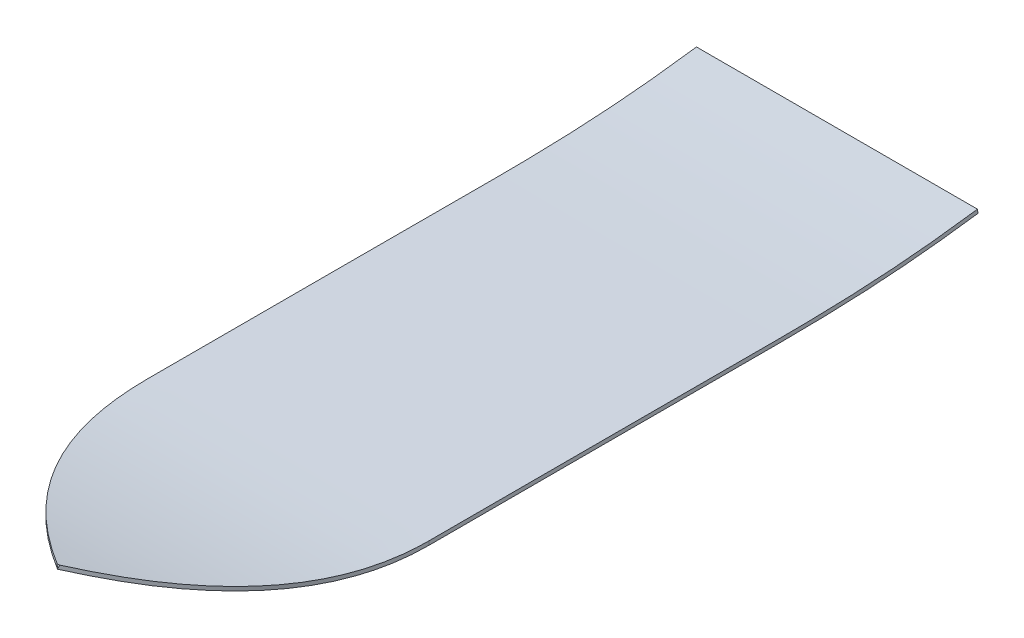
from build123d import *

# Parameters (mm, degrees)
BOSS_EXTRUDE1_DEPTH      = 1524
BOSS_EXTRUDE1_DEPTH_BACK = 1524
CUT_EXTRUDE1_DEPTH       = 3098.447821487
CUT_EXTRUDE1_DEPTH_BACK  = 3098.447821487
SKETCH3_W                = 5731.45735109
SKETCH3_H                = 8003.30588206


with BuildPart() as part:
    # Sketch1 → Boss-Extrude1 (new, two sides: drawn at the far end of the back side and taken through both)
    with BuildSketch(Plane(origin=(0, 0, 0), x_dir=(0, 0, -1), z_dir=(1, 0, 0)).offset(-BOSS_EXTRUDE1_DEPTH_BACK)):
        with BuildLine():
            Line((-2353.490963465, -376.584606087), (-2348.039723593, -352.186163845))
            add(Edge.make_bspline(
                [(-2348.039723593, -352.186163845), (-2281.6738737, -367.014002585), (-2145.036602461, -397.354481422), (-1955.256616807, -429.884051114), (-1782.28988813, -454.42437367), (-1631.35939755, -471.996800914), (-1477.832014657, -486.206040379), (-1315.18129302, -497.476466704), (-1143.018170233, -505.304212274), (-1011.507391034, -508.081800201), (-929.720530859, -508.681005908), (-905.793973442, -508.762455141), (-888.668966845, -508.775812404), (-868.10178753, -508.769602755), (-768.707408439, -508.757272838), (-590.482173842, -508.734088186), (-316.288189813, -508.696715915), (-14.674899897, -508.655726234), (314.357795542, -508.610990104), (677.664730089, -508.561593962), (951.858615248, -508.522926374), (1124.943610655, -508.503796038), (1155.78937311, -508.512090205), (1167.787147852, -508.486000899), (1176.347816812, -508.587253885), (1197.689978263, -508.761102451), (1294.258027958, -509.449807286), (1408.722423658, -509.443255017), (1531.687347091, -508.118726482), (1606.796786484, -506.846040881), (1681.020023121, -505.093260979), (1754.520691799, -502.832440084), (1827.461095667, -500.036457542), (1924.190978685, -495.55466042), (2044.492665021, -488.492256563), (2213.50789637, -475.490937752), (2408.667866621, -456.44949581), (2562.784610399, -436.038918355), (2639.842982287, -425.833629628)],
                knots=[0.002527185, 0.002527185, 0.002527185, 0.002527185, 0.046875, 0.09375, 0.125, 0.15625, 0.1875, 0.21875, 0.25390625, 0.2890625, 0.294921875, 0.30078125, 0.302734375, 0.3046875, 0.3125, 0.359375, 0.40625, 0.46875, 0.53125, 0.59375, 0.67578125, 0.6875, 0.692382812, 0.693359375, 0.694335938, 0.697265625, 0.705566406, 0.75, 0.765625, 0.78125, 0.796875, 0.8125, 0.828125, 0.84375, 0.875, 0.90625, 0.953125, 1, 1, 1, 1], degree=3))
            Line((2639.842982287, -425.833629628), (2643.125218945, -450.617231515))
            add(Edge.make_bspline(
                [(-2353.490963465, -376.584606087), (-2341.81715528, -379.192835252), (-2318.483163292, -384.400676726), (-2271.676988037, -394.754475772), (-2212.90304103, -407.455435482), (-2141.599907413, -421.947184483), (-2069.463250553, -435.350726797), (-1996.644398819, -447.790733752), (-1898.742240086, -463.225422643), (-1774.853328452, -480.583246216), (-1623.513682306, -497.941169046), (-1469.625311519, -511.942724458), (-1313.140636083, -522.554949189), (-1180.58779835, -528.583557355), (-1073.252288744, -531.716582956), (-1005.631489175, -532.971211102), (-951.207524783, -533.552085557), (-917.067998419, -533.740725986), (-889.647943185, -533.780490952), (-862.287186659, -533.765712964), (-828.107299818, -533.7657076), (-787.080038096, -533.759175111), (-732.380917206, -533.752630625), (-636.655460733, -533.739919525), (-499.905395342, -533.721788597), (-335.804664178, -533.699372735), (-171.704110201, -533.677070131), (-7.60352333, -533.654761868), (156.497058307, -533.632453691), (320.597642313, -533.610142066), (484.698231036, -533.587829734), (648.798882925, -533.56532168), (785.549328587, -533.546290869), (894.949580645, -533.531600009), (963.324680061, -533.522824353), (1018.02479195, -533.516037432), (1059.049720286, -533.51133736), (1093.237616721, -533.506910258), (1117.165344366, -533.506162519), (1130.838374939, -533.506963832), (1141.090310784, -533.508828963), (1149.648034144, -533.509381469), (1156.503452511, -533.50504743), (1160.790900683, -533.500162564), (1164.225316727, -533.493292797), (1166.696889658, -533.491829219), (1169.074115262, -533.504941801), (1171.573238532, -533.531729037), (1174.165233642, -533.560286074), (1177.598314417, -533.594374084), (1183.596284408, -533.647890401), (1192.102050573, -533.71404517), (1205.680140041, -533.817160188), (1229.349222691, -533.981509955), (1262.907726008, -534.165058875), (1316.067262702, -534.339023224), (1381.573298455, -534.325988137), (1458.830900277, -533.913280533), (1534.901440856, -533.076258507), (1634.96164713, -531.357095022), (1757.876509137, -528.009155765), (1903.211676777, -521.844090886), (2047.653049228, -513.333940218), (2168.434252599, -504.024862577), (2265.66369639, -495.324461833), (2339.250884359, -488.037032468), (2413.836412297, -479.855137369), (2489.664662871, -470.659158673), (2566.226101757, -460.801462085), (2617.514861733, -454.008960193), (2643.125218945, -450.617231515)],
                knots=[0.002527185, 0.002527185, 0.002527185, 0.002527185, 0.010319941, 0.018112698, 0.03369821, 0.049283723, 0.064869236, 0.080454749, 0.096040261, 0.127211287, 0.158382312, 0.189553338, 0.220724363, 0.251895389, 0.267480901, 0.283066414, 0.290859171, 0.298651927, 0.302548305, 0.306444683, 0.31423744, 0.322030196, 0.329822952, 0.345408465, 0.376579491, 0.407750516, 0.438921542, 0.470092567, 0.501263592, 0.532434618, 0.563605643, 0.594776669, 0.625947694, 0.641533207, 0.65711872, 0.664911476, 0.672704233, 0.680496989, 0.684393367, 0.686341556, 0.688289745, 0.690237934, 0.691212029, 0.692186123, 0.692673171, 0.693160218, 0.693647265, 0.694134313, 0.69462136, 0.695108407, 0.696082502, 0.698030691, 0.69997888, 0.703875258, 0.711668014, 0.719460771, 0.735046283, 0.750631796, 0.766217309, 0.781802822, 0.812973847, 0.844144873, 0.875315898, 0.906486924, 0.922072436, 0.937657949, 0.953243462, 0.968828975, 0.984414487, 1, 1, 1, 1], degree=3))
        make_face()
    extrude(amount=BOSS_EXTRUDE1_DEPTH + BOSS_EXTRUDE1_DEPTH_BACK)

    # Sketch3 → Cut-Extrude1 (cut, two sides: drawn at the far end of the back side and taken through both)
    with BuildSketch(Plane(origin=(0, 0, 0), x_dir=(1, 0, 0), z_dir=(0, 1, 0)).offset(-CUT_EXTRUDE1_DEPTH_BACK)):
        with Locations((-68.47307406, 83.588987295)):
            Rectangle(SKETCH3_W, SKETCH3_H)
        with BuildLine():
            Line((-900, 2643.745048715), (900, 2643.745048715))
            Line((900, 2643.745048715), (900, -873.788601837))
            add(Edge.make_bspline(
                [(900, -873.788601837), (900, -1748.42720702), (0, -2353.490963465)],
                knots=[0, 0, 0, 1, 1, 1], degree=2))
            add(Edge.make_bspline(
                [(-900, -873.788601837), (-900, -1748.42720702), (0, -2353.490963465)],
                knots=[0, 0, 0, 1, 1, 1], degree=2))
            Line((-900, -873.788601837), (-900, 2643.745048715))
        make_face(mode=Mode.SUBTRACT)
    extrude(amount=CUT_EXTRUDE1_DEPTH + CUT_EXTRUDE1_DEPTH_BACK, mode=Mode.SUBTRACT)


solid = part.part
